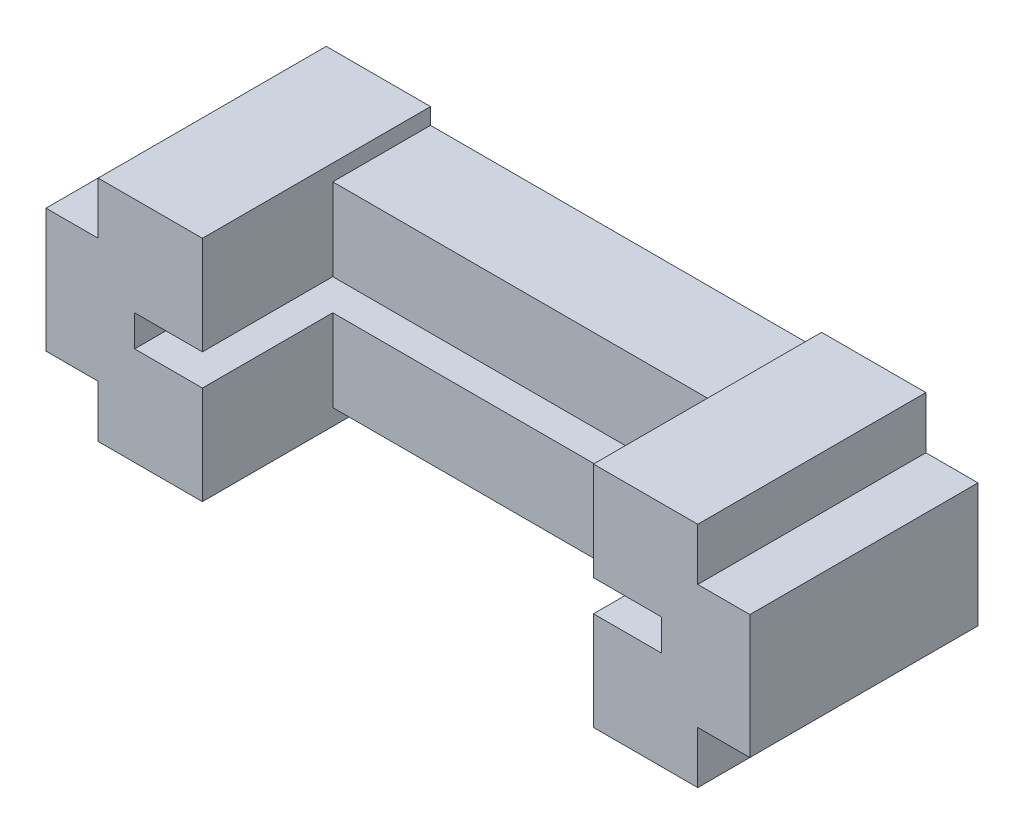
from build123d import *

# Parameters (mm, degrees)
BOSS_EXTRUDE1_DEPTH     = 9.525
BOSS_EXTRUDE2_DEPTH     = 12.7
SKETCH4_W               = 51.308
SKETCH4_H               = 3.048
CUT_EXTRUDE1_DEPTH      = 6.096
CUT_EXTRUDE2_DEPTH      = 39.217558219
CUT_EXTRUDE2_DEPTH_BACK = 39.217558219
SKETCH5_W               = 38.1
SKETCH5_H               = 1.5875


with BuildPart() as part:
    # Sketch1 → Boss-Extrude1 (new body)
    with BuildSketch(Plane.XY):
        Polygon((-29.21, -11.1125), (29.21, -11.1125), (29.21, -6.0325), (34.29, -6.0325), (34.29, 6.0325), (29.21, 6.0325), (29.21, 11.1125), (-29.21, 11.1125), (-29.21, 6.0325), (-34.29, 6.0325), (-34.29, -6.0325), (-29.21, -6.0325), align=None)
    extrude(amount=BOSS_EXTRUDE1_DEPTH)

    # Sketch3 → Boss-Extrude2 (add)
    with BuildSketch(Plane.XY.offset(9.525)):
        Polygon((-29.21, 11.1125), (-19.05, 11.1125), (-19.05, 1.524), (-25.654, 1.524), (-25.654, -1.524), (-19.05, -1.524), (-19.05, -11.1125), (-29.21, -11.1125), (-29.21, -6.0325), (-34.29, -6.0325), (-34.29, 6.0325), (-29.21, 6.0325), align=None)
        Polygon((19.05, -1.524), (19.05, -11.1125), (29.21, -11.1125), (29.21, -6.0325), (34.29, -6.0325), (34.29, 6.0325), (29.21, 6.0325), (29.21, 11.1125), (19.05, 11.1125), (19.05, 1.524), (25.654, 1.524), (25.654, -1.524), align=None)
    extrude(amount=BOSS_EXTRUDE2_DEPTH)

    # Sketch4 → Cut-Extrude1 (cut)
    with BuildSketch(Plane.XY.offset(9.525)):
        Rectangle(SKETCH4_W, SKETCH4_H)
    extrude(amount=-CUT_EXTRUDE1_DEPTH, mode=Mode.SUBTRACT)

    # Sketch5 → Cut-Extrude2 (cut, two sides: drawn at the far end of the back side and taken through both)
    with BuildSketch(Plane.XY.offset(9.525).offset(-CUT_EXTRUDE2_DEPTH_BACK)):
        with Locations((0, 10.31875)):
            Rectangle(SKETCH5_W, SKETCH5_H)
        with Locations((0, -10.31875)):
            Rectangle(SKETCH5_W, SKETCH5_H)
    extrude(amount=CUT_EXTRUDE2_DEPTH + CUT_EXTRUDE2_DEPTH_BACK, mode=Mode.SUBTRACT)


solid = part.part
